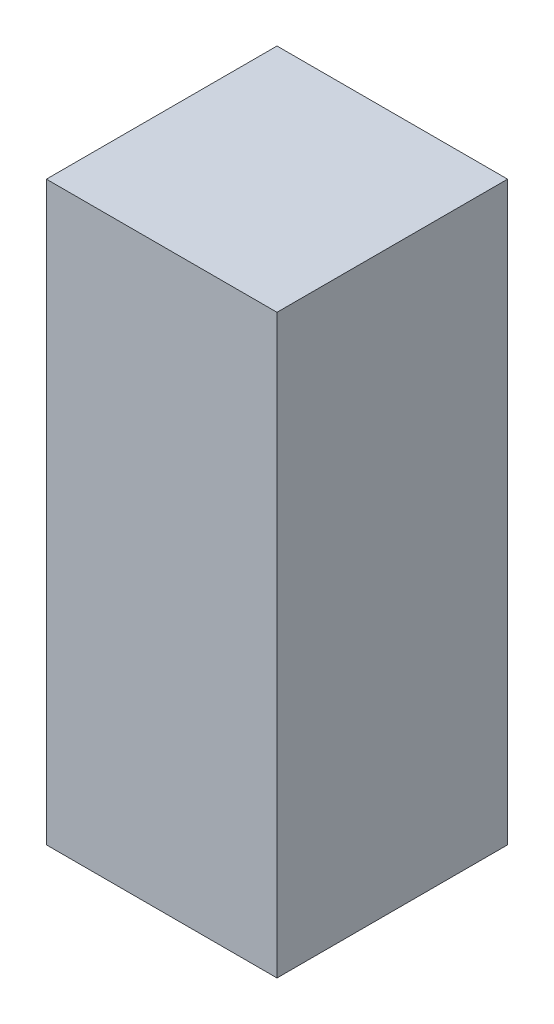
from build123d import *

# Parameters (mm, degrees)
SKETCH_1_W      = 20
SKETCH_1_H      = 20
EXTRUDE_1_DEPTH = 50


with BuildPart() as part:
    # 草圖1 → 填料-伸長1 (new body)
    with BuildSketch(Plane(origin=(0, 0, 0), x_dir=(1, 0, 0), z_dir=(0, 1, 0))):
        Rectangle(SKETCH_1_W, SKETCH_1_H)
    extrude(amount=EXTRUDE_1_DEPTH)


solid = part.part
